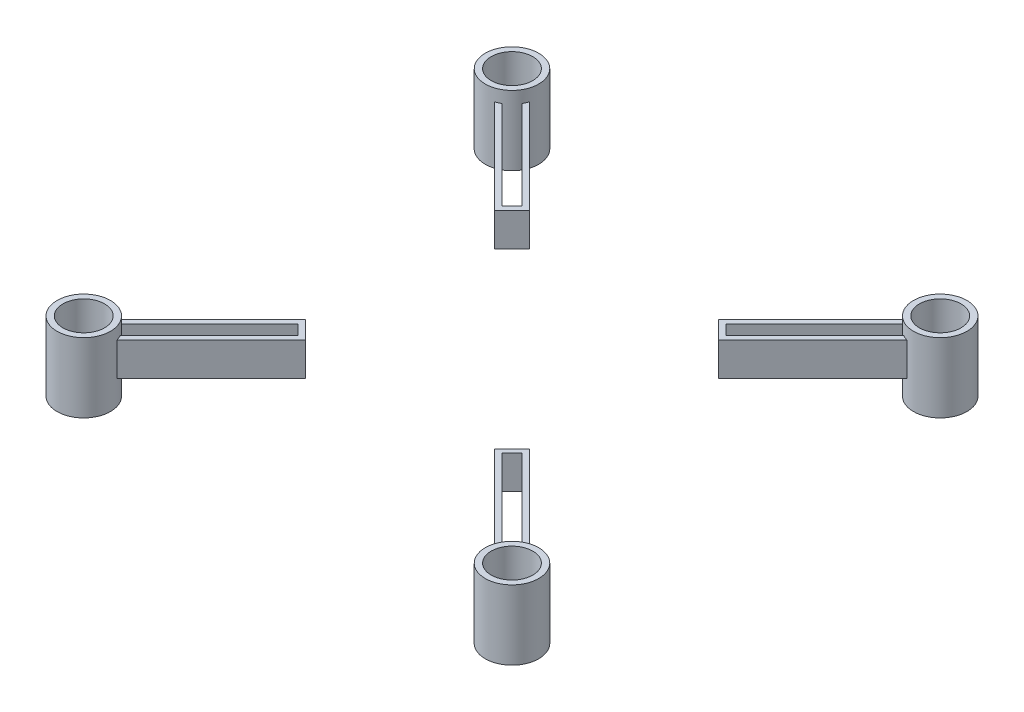
from build123d import *

# Parameters (mm, degrees)
SKETCH1_R             = 3.799855969
SKETCH1_R_2           = 2.96
BOSS_EXTRUDE1_DEPTH   = 9.89
BOSS_EXTRUDE1_2_DEPTH = 9.89
BOSS_EXTRUDE1_3_DEPTH = 9.89
BOSS_EXTRUDE1_4_DEPTH = 9.89
BOSS_EXTRUDE2_START   = -4.74
BOSS_EXTRUDE2_DEPTH   = 4.74


with BuildPart() as part:
    # Sketch1 → Boss-Extrude1 (new body)
    with BuildSketch(Plane(origin=(0, 0, 0), x_dir=(1, 0, 0), z_dir=(0, 1, 0))):
        with Locations(Location((-30.445, -30.445, 0), (0, 0, 270))):
            Circle(SKETCH1_R)
        with Locations(Location((-30.445, -30.445, 0), (0, 0, 270))):
            Circle(SKETCH1_R_2, mode=Mode.SUBTRACT)
    extrude(amount=BOSS_EXTRUDE1_DEPTH)


with BuildPart() as body_2:
    # Sketch1 → Boss-Extrude1 2 (new body)
    with BuildSketch(Plane(origin=(0, 0, 0), x_dir=(1, 0, 0), z_dir=(0, 1, 0))):
        with Locations(Location((-30.445, 30.445, 0), (0, 0, 270))):
            Circle(SKETCH1_R)
        with Locations(Location((-30.445, 30.445, 0), (0, 0, 270))):
            Circle(SKETCH1_R_2, mode=Mode.SUBTRACT)
    extrude(amount=BOSS_EXTRUDE1_2_DEPTH)

    # Sketch2 → Boss-Extrude2 (add)
    with BuildSketch(Plane(origin=(0, 8.180000118, 0), x_dir=(1, 0, 0), z_dir=(0, 1, 0)).offset(BOSS_EXTRUDE2_START)):
        with BuildLine():
            Line((-26.815816595, 29.318974601), (-13.426848066, 15.930006071))
            Line((-13.426848066, 15.930006071), (-15.930006071, 13.426848066))
            Line((-15.930006071, 13.426848066), (-29.318974601, 26.815816595))
            ThreePointArc((-29.318974601, 26.815816595), (-28.939956198, 26.95591007), (-28.577957455, 27.135459621))
            Line((-28.577957455, 27.135459621), (-15.930006071, 14.487508237))
            Line((-15.930006071, 14.487508237), (-14.487508237, 15.930006071))
            Line((-14.487508237, 15.930006071), (-27.135459621, 28.577957455))
            ThreePointArc((-27.135459621, 28.577957455), (-26.95591007, 28.939956198), (-26.815816595, 29.318974601))
        make_face()
        with BuildLine():
            Line((29.318974601, 26.815816595), (15.930006071, 13.426848066))
            Line((15.930006071, 13.426848066), (13.426848066, 15.930006071))
            Line((13.426848066, 15.930006071), (26.815816595, 29.318974601))
            ThreePointArc((26.815816595, 29.318974601), (26.95591007, 28.939956198), (27.135459621, 28.577957455))
            Line((27.135459621, 28.577957455), (14.487508237, 15.930006071))
            Line((14.487508237, 15.930006071), (15.930006071, 14.487508237))
            Line((15.930006071, 14.487508237), (28.577957455, 27.135459621))
            ThreePointArc((28.577957455, 27.135459621), (28.939956198, 26.95591007), (29.318974601, 26.815816595))
        make_face()
        with BuildLine():
            Line((26.815816595, -29.318974601), (13.426848066, -15.930006071))
            Line((13.426848066, -15.930006071), (15.930006071, -13.426848066))
            Line((15.930006071, -13.426848066), (29.318974601, -26.815816595))
            ThreePointArc((29.318974601, -26.815816595), (28.939956198, -26.95591007), (28.577957455, -27.135459621))
            Line((28.577957455, -27.135459621), (15.930006071, -14.487508237))
            Line((15.930006071, -14.487508237), (14.487508237, -15.930006071))
            Line((14.487508237, -15.930006071), (27.135459621, -28.577957455))
            ThreePointArc((27.135459621, -28.577957455), (26.95591007, -28.939956198), (26.815816595, -29.318974601))
        make_face()
        with BuildLine():
            Line((-29.318974601, -26.815816595), (-15.930006071, -13.426848066))
            Line((-15.930006071, -13.426848066), (-13.426848066, -15.930006071))
            Line((-13.426848066, -15.930006071), (-26.815816595, -29.318974601))
            ThreePointArc((-26.815816595, -29.318974601), (-26.95591007, -28.939956198), (-27.135459621, -28.577957455))
            Line((-27.135459621, -28.577957455), (-14.487508237, -15.930006071))
            Line((-14.487508237, -15.930006071), (-15.930006071, -14.487508237))
            Line((-15.930006071, -14.487508237), (-28.577957455, -27.135459621))
            ThreePointArc((-28.577957455, -27.135459621), (-28.939956198, -26.95591007), (-29.318974601, -26.815816595))
        make_face()
    extrude(amount=BOSS_EXTRUDE2_DEPTH)


with BuildPart() as body_3:
    # Sketch1 → Boss-Extrude1 3 (new body)
    with BuildSketch(Plane(origin=(0, 0, 0), x_dir=(1, 0, 0), z_dir=(0, 1, 0))):
        with Locations(Location((30.445, 30.445, 0), (0, 0, 270))):
            Circle(SKETCH1_R)
        with Locations(Location((30.445, 30.445, 0), (0, 0, 270))):
            Circle(SKETCH1_R_2, mode=Mode.SUBTRACT)
    extrude(amount=BOSS_EXTRUDE1_3_DEPTH)


with BuildPart() as body_4:
    # Sketch1 → Boss-Extrude1 4 (new body)
    with BuildSketch(Plane(origin=(0, 0, 0), x_dir=(1, 0, 0), z_dir=(0, 1, 0))):
        with Locations(Location((30.445, -30.445, 0), (0, 0, 270))):
            Circle(SKETCH1_R)
        with Locations(Location((30.445, -30.445, 0), (0, 0, 270))):
            Circle(SKETCH1_R_2, mode=Mode.SUBTRACT)
    extrude(amount=BOSS_EXTRUDE1_4_DEPTH)


with BuildPart() as boss_extrude2_piece_1:
    # of the separate pieces the step leaves, piece 1, a body of its own (boss_extrude2_pieces)
    add(body_2.part.solids().sort_by_distance((-30.445, 0, -26.645144031))[0])


with BuildPart() as boss_extrude2_piece_2:
    # of the separate pieces the step leaves, piece 2, a body of its own (boss_extrude2_pieces)
    add(body_2.part.solids().sort_by_distance((29.318974601, 3.440000118, -26.815816595))[0])


with BuildPart() as boss_extrude2_piece_3:
    # of the separate pieces the step leaves, piece 3, a body of its own (boss_extrude2_pieces)
    add(body_2.part.solids().sort_by_distance((26.815816595, 3.440000118, 29.318974601))[0])


with BuildPart() as boss_extrude2_piece_4:
    # of the separate pieces the step leaves, piece 4, a body of its own (boss_extrude2_pieces)
    add(body_2.part.solids().sort_by_distance((-29.318974601, 3.440000118, 26.815816595))[0])


solid = Compound([part.part, body_3.part, body_4.part, boss_extrude2_piece_1.part, boss_extrude2_piece_2.part, boss_extrude2_piece_3.part, boss_extrude2_piece_4.part])
